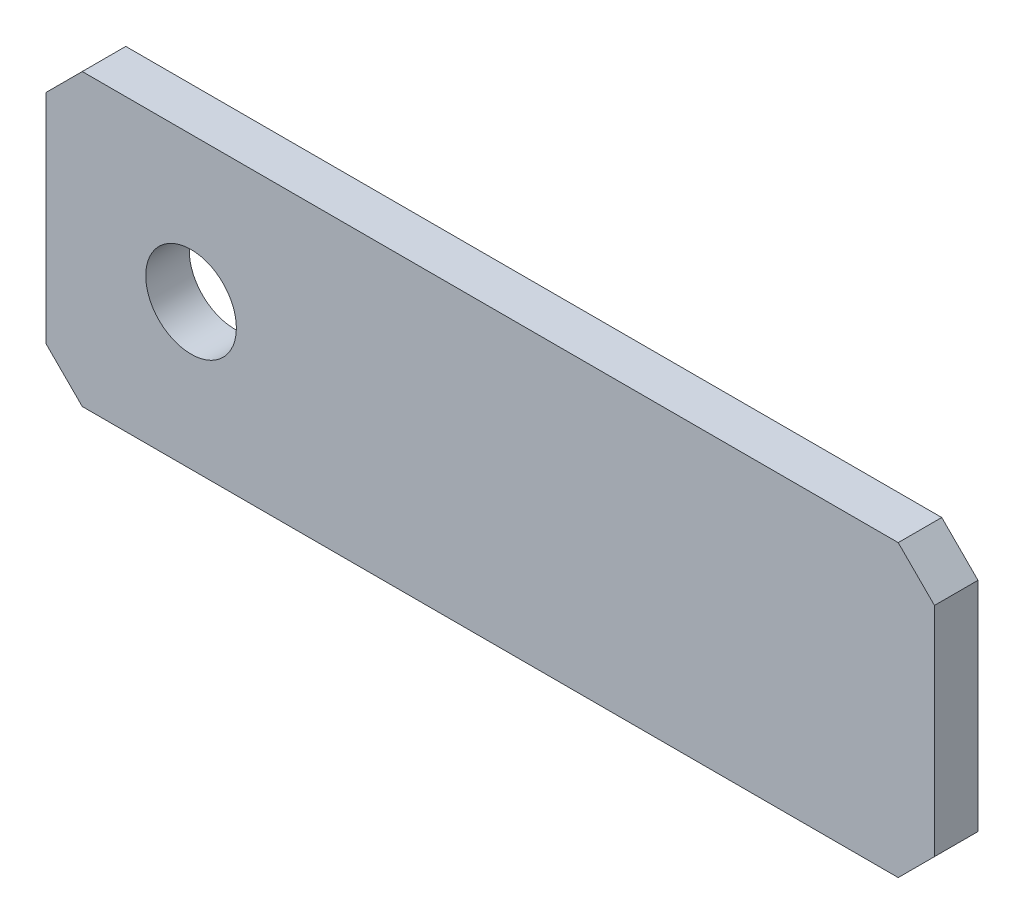
from build123d import *

# Parameters (mm, degrees)
SKETCH_24_5_8_6_3_5_11_5_R = 1.25
EXTRUDE_1_2_DEPTH          = 1.2


with BuildPart() as part:
    # 草图_外形24点5乘8_孔位负6_3点5_11点5 → 拉伸_板厚1点2_孔贯穿 (new body)
    with BuildSketch(Plane.XY):
        Polygon((-10, 17.5), (-9, 16.5), (13.5, 16.5), (14.5, 17.5), (14.5, 23.5), (13.5, 24.5), (-9, 24.5), (-10, 23.5), align=None)
        with Locations((-6, 20.5)):
            Circle(SKETCH_24_5_8_6_3_5_11_5_R, mode=Mode.SUBTRACT)
    extrude(amount=EXTRUDE_1_2_DEPTH)


solid = part.part
